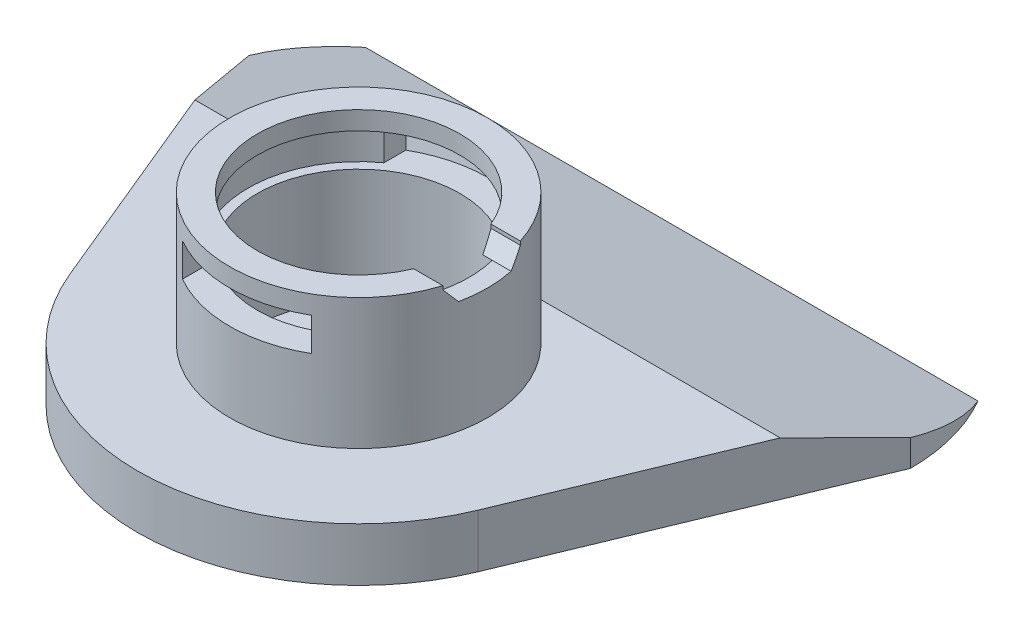
from build123d import *

# Parameters (mm, degrees)
BOSS_EXTRUDE1_DEPTH      = 2.9
SKETCH1_3_R              = 7
BOSS_EXTRUDE2_DEPTH      = 10
SKETCH7_R                = 5.5
CUT_EXTRUDE10_DEPTH      = 9
SKETCH8_R                = 6
SKETCH8_R_2              = 5.5
CUT_EXTRUDE11_DEPTH      = 1.8
CUT_EXTRUDE12_DEPTH      = 27.674619931
CUT_EXTRUDE12_DEPTH_BACK = 27.674619931
SKETCH9_W                = 7
SKETCH9_H                = 1.8
CUT_EXTRUDE13_DEPTH      = 27.674619931
CUT_EXTRUDE13_DEPTH_BACK = 27.674619931
CUT_EXTRUDE14_DEPTH      = 10


with BuildPart() as part:
    # Sketch1 → Boss-Extrude1 (new body)
    with BuildSketch(Plane(origin=(0, 0, 0), x_dir=(1, 0, 0), z_dir=(0, 1, 0))):
        with BuildLine():
            Line((-17.959269152, 12), (-11.086554257, -4.59220151))
            ThreePointArc((-11.086554257, -4.59220151), (1.96e-07, -12), (11.086554407, -4.592201147))
            Line((11.086554407, -4.592201147), (17.959269152, 12))
            Line((17.959269152, 12), (17.959269152, 12.01))
            ThreePointArc((17.959269152, 12.01), (17.619614776, 14.59281423), (16.623747761, 17))
            Line((16.623747761, 17), (-16.623747761, 17))
            ThreePointArc((-16.623747761, 17), (-17.619614776, 14.59281423), (-17.959269152, 12.01))
            Line((-17.959269152, 12.01), (-17.959269152, 12))
        make_face()
    extrude(amount=BOSS_EXTRUDE1_DEPTH)

    # Sketch1<3> → Boss-Extrude2 (add)
    with BuildSketch(Plane(origin=(0, 0, 0), x_dir=(1, 0, 0), z_dir=(0, 1, 0))):
        Circle(SKETCH1_3_R)
    extrude(amount=BOSS_EXTRUDE2_DEPTH)

    # Sketch7 → Cut-Extrude10 (cut)
    with BuildSketch(Plane(origin=(0, 10, 0), x_dir=(1, 0, 0), z_dir=(0, 1, 0))):
        Circle(SKETCH7_R)
    extrude(amount=-CUT_EXTRUDE10_DEPTH, mode=Mode.SUBTRACT)

    # Sketch8 → Cut-Extrude11 (cut)
    with BuildSketch(Plane(origin=(0, 9, 0), x_dir=(1, 0, 0), z_dir=(0, 1, 0))):
        Circle(SKETCH8_R)
        Circle(SKETCH8_R_2, mode=Mode.SUBTRACT)
    extrude(amount=-CUT_EXTRUDE11_DEPTH, mode=Mode.SUBTRACT)

    # Sketch9 → Cut-Extrude12 (cut, two sides: drawn at the far end of the back side and taken through both)
    with BuildSketch(Plane.XY.offset(-CUT_EXTRUDE12_DEPTH_BACK)):
        with Locations((0, 8.1)):
            Rectangle(SKETCH9_W, SKETCH9_H)
    extrude(amount=CUT_EXTRUDE12_DEPTH + CUT_EXTRUDE12_DEPTH_BACK, mode=Mode.SUBTRACT)

    # Sketch10 → Cut-Extrude13 (cut, two sides: drawn at the far end of the back side and taken through both)
    with BuildSketch(Plane(origin=(0, 0, 0), x_dir=(0, 0, -1), z_dir=(1, 0, 0)).offset(-CUT_EXTRUDE13_DEPTH_BACK)):
        Polygon((17, 0), (7, 2.9), (17, 2.9), align=None)
    extrude(amount=CUT_EXTRUDE13_DEPTH + CUT_EXTRUDE13_DEPTH_BACK, mode=Mode.SUBTRACT)

    # Sketch11 → Cut-Extrude14 (cut)
    with BuildSketch(Plane(origin=(0, 0, 0), x_dir=(0, 0, -1), z_dir=(1, 0, 0))):
        Polygon((-2.1, 10.6), (2.1, 10.6), (2.1, 9.8), (1.428720295, 9), (-1.428720295, 9), (-2.1, 9.8), align=None)
    extrude(amount=CUT_EXTRUDE14_DEPTH, mode=Mode.SUBTRACT)


solid = part.part
